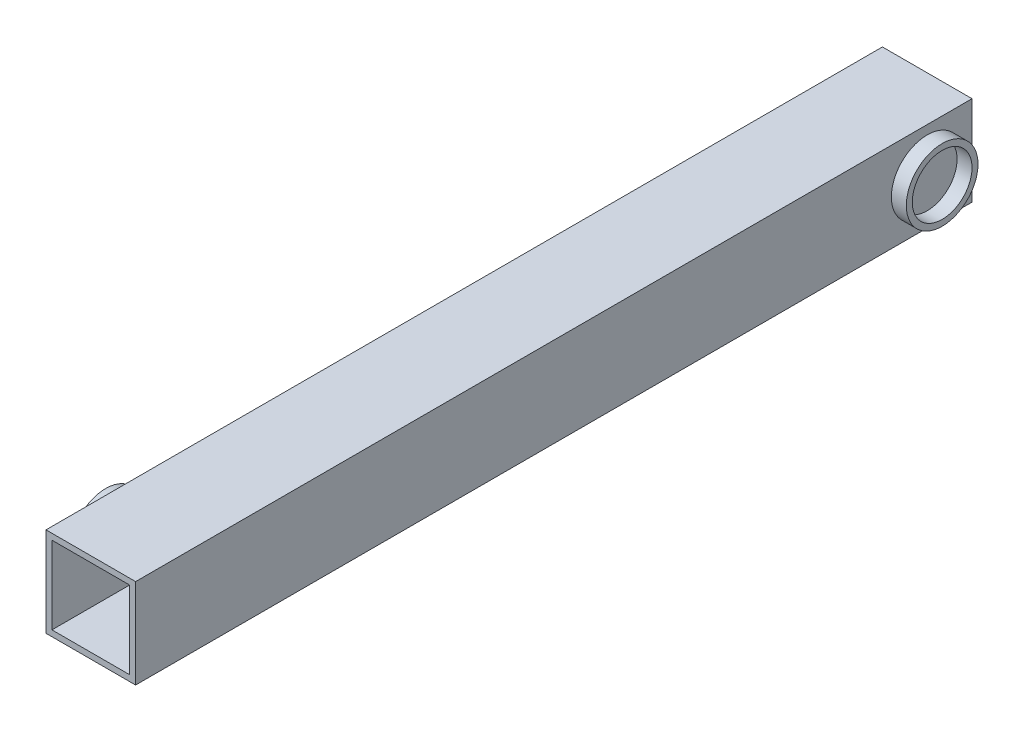
from build123d import *

# Parameters (mm, degrees)
SKETCH1_W           = 30
SKETCH1_H           = 30
SKETCH1_W_2         = 26
SKETCH1_H_2         = 26
BOSS_EXTRUDE1_DEPTH = 280
SKETCH2_R           = 12
SKETCH2_R_2         = 10
BOSS_EXTRUDE2_DEPTH = 5
SKETCH3_R           = 12
SKETCH3_R_2         = 10
BOSS_EXTRUDE3_DEPTH = 5


with BuildPart() as part:
    # Sketch1 → Boss-Extrude1 (new body)
    with BuildSketch(Plane.XY):
        Rectangle(SKETCH1_W, SKETCH1_H)
        Rectangle(SKETCH1_W_2, SKETCH1_H_2, mode=Mode.SUBTRACT)
    extrude(amount=BOSS_EXTRUDE1_DEPTH)

    # Sketch2 → Boss-Extrude2 (add)
    with BuildSketch(Plane(origin=(15, 0, 0), x_dir=(0, 0, -1), z_dir=(1, 0, 0))):
        with Locations(Location((-15, 0, 0), (0, 0, 180))):
            Circle(SKETCH2_R)
        with Locations((-15, 0)):
            Circle(SKETCH2_R_2, mode=Mode.SUBTRACT)
    extrude(amount=BOSS_EXTRUDE2_DEPTH)

    # Sketch3 → Boss-Extrude3 (add)
    with BuildSketch(Plane.ZY.offset(15)):
        with Locations(Location((255, 0, 0), (0, 0, 180))):
            Circle(SKETCH3_R)
        with Locations((255, 0)):
            Circle(SKETCH3_R_2, mode=Mode.SUBTRACT)
    extrude(amount=BOSS_EXTRUDE3_DEPTH)


solid = part.part
